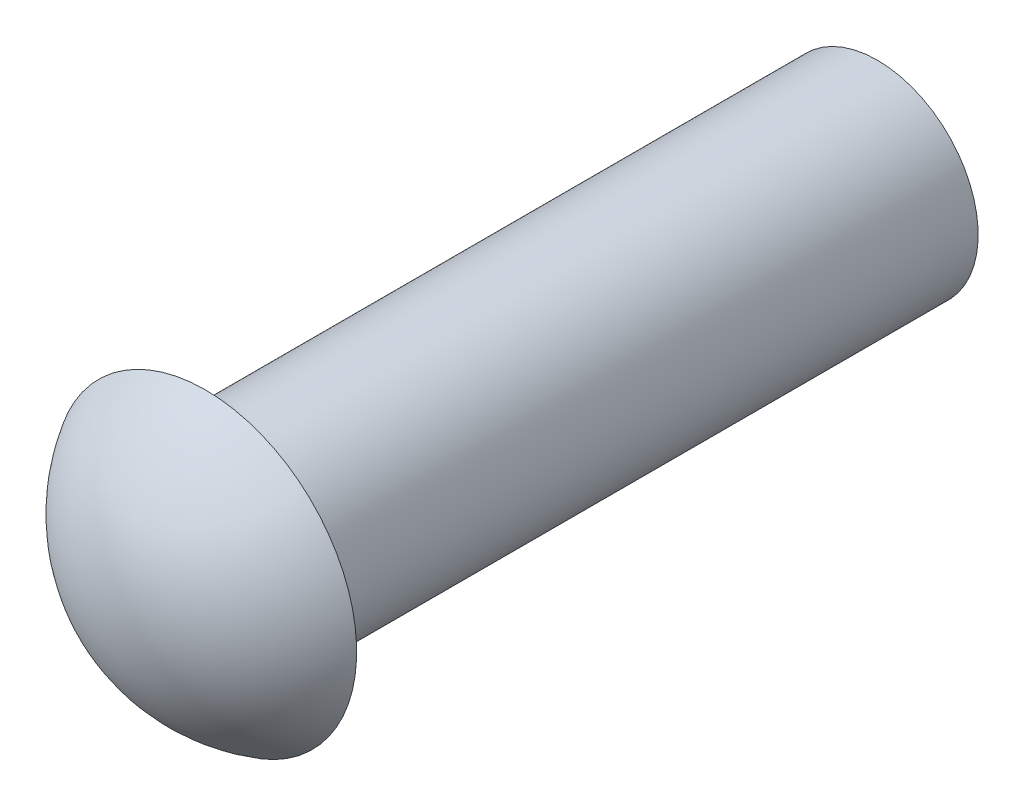
from build123d import *

# Parameters (mm, degrees)
SKETCH1_W = 3.000000096
SKETCH1_H = 19.999999878


with BuildPart() as part:
    # Sketch1 → Revolve2 (revolve)
    with BuildSketch(Plane.YZ):
        with BuildLine():
            Line((-3.000000096, 22.598076026), (-3.000000096, 19.999999878))
            Line((-3.000000096, 19.999999878), (0, 19.999999878))
            Line((0, 19.999999878), (1.499999794, 19.999999878))
            ThreePointArc((1.499999794, 19.999999878), (-0.401923948, 21.90192362), (-3.000000096, 22.598076026))
        make_face()
        with Locations((-1.500000048, 9.999999939)):
            Rectangle(SKETCH1_W, SKETCH1_H)
    revolve(axis=Axis((0, -3.000000096, 0), (0, 0, 1)))


solid = part.part
